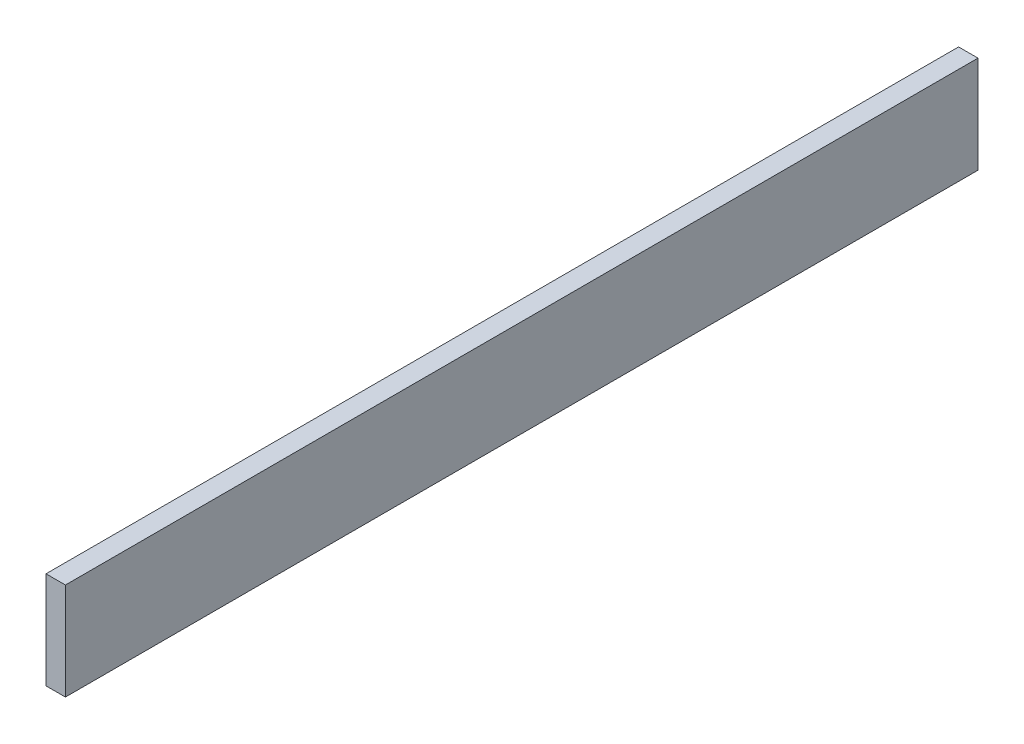
from build123d import *

# Parameters (mm, degrees)
SKETCH1_W           = 470
SKETCH1_H           = 50
BOSS_EXTRUDE1_DEPTH = 10


with BuildPart() as part:
    # Sketch1 → Boss-Extrude1 (new body)
    with BuildSketch(Plane(origin=(0, 0, 0), x_dir=(0, 0, -1), z_dir=(1, 0, 0))):
        with Locations((235, 25)):
            Rectangle(SKETCH1_W, SKETCH1_H)
    extrude(amount=BOSS_EXTRUDE1_DEPTH)


solid = part.part
